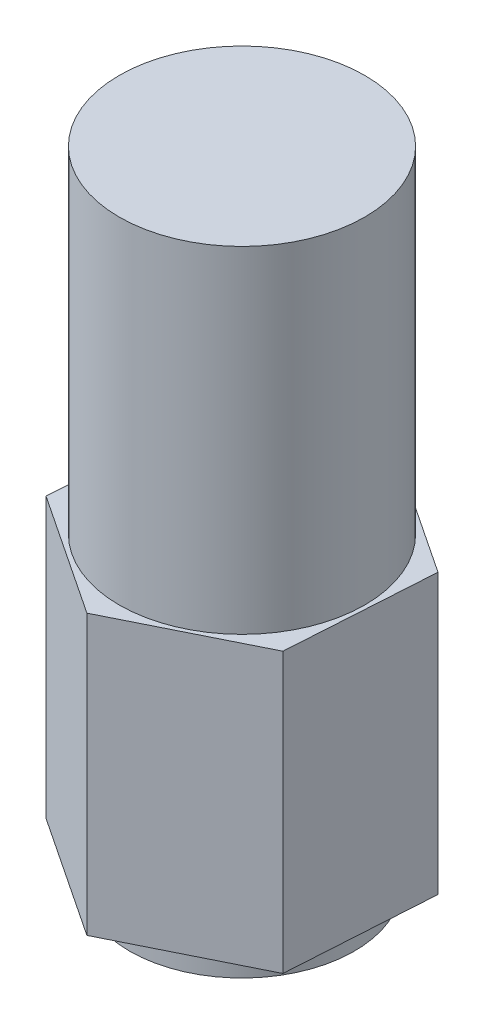
from build123d import *

# Parameters (mm, degrees)
SKETCH_1_R      = 4.35
EXTRUDE_1_DEPTH = 1
EXTRUDE_2_DEPTH = 10.8
SKETCH_3_R      = 4.75
EXTRUDE_3_DEPTH = 13


with BuildPart() as part:
    # 草图1 → 凸台-拉伸1 (new body)
    with BuildSketch(Plane(origin=(0, 0, 0), x_dir=(1, 0, 0), z_dir=(0, 1, 0))):
        with Locations(Location((0, 0, 0), (0, 0, 270))):
            Circle(SKETCH_1_R)
    extrude(amount=EXTRUDE_1_DEPTH)

    # 草图2 → 凸台-拉伸2 (add)
    with BuildSketch(Plane(origin=(0, 1, 0), x_dir=(1, 0, 0), z_dir=(0, 1, 0))):
        Polygon((4.712937582, -3.130743152), (5.067771893, 2.516152096), (0.354834312, 5.646895248), (-4.712937582, 3.130743152), (-5.067771893, -2.516152096), (-0.354834312, -5.646895248), align=None)
    extrude(amount=EXTRUDE_2_DEPTH)

    # 草图3 → 凸台-拉伸3 (add)
    with BuildSketch(Plane(origin=(0, 11.8, 0), x_dir=(1, 0, 0), z_dir=(0, 1, 0))):
        with Locations(Location((0, 0, 0), (0, 0, 90))):
            Circle(SKETCH_3_R)
    extrude(amount=EXTRUDE_3_DEPTH)


solid = part.part
